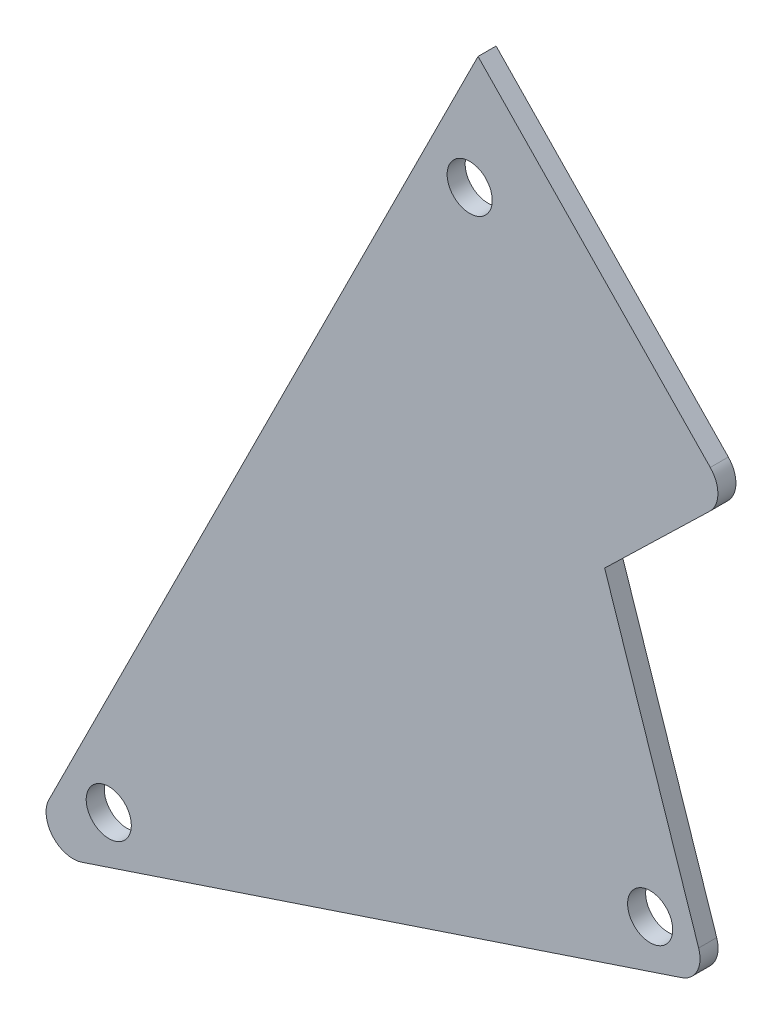
from build123d import *

# Parameters (mm, degrees)
SKETCH1_R           = 3.175
BOSS_EXTRUDE1_DEPTH = 2.54
FILLET1_R           = 3.81


with BuildPart() as part:
    # Sketch1 → Boss-Extrude1 (new body)
    with BuildSketch(Plane.XY):
        Polygon((-24.223713703, 118.151604251), (-88.735511623, -10.871991588), (8.032185257, 21.383907372), (-6.404519195, 64.694020727), (11.113552526, 81.656157748), align=None)
        with Locations((-76.2, 0)):
            Circle(SKETCH1_R, mode=Mode.SUBTRACT)
        with Locations((0, 25.4)):
            Circle(SKETCH1_R, mode=Mode.SUBTRACT)
        with Locations((-25.4, 101.6)):
            Circle(SKETCH1_R, mode=Mode.SUBTRACT)
    extrude(amount=BOSS_EXTRUDE1_DEPTH)

    # Fillet1
    fillet1_edges = [part.edges().sort_by_distance(p)[0] for p in [
        (11.113552526, 81.656157748, 1.27),
        (8.032185257, 21.383907372, 1.27),
        (-88.735511623, -10.871991588, 1.27),
    ]]
    fillet(fillet1_edges, radius=FILLET1_R)


solid = part.part
